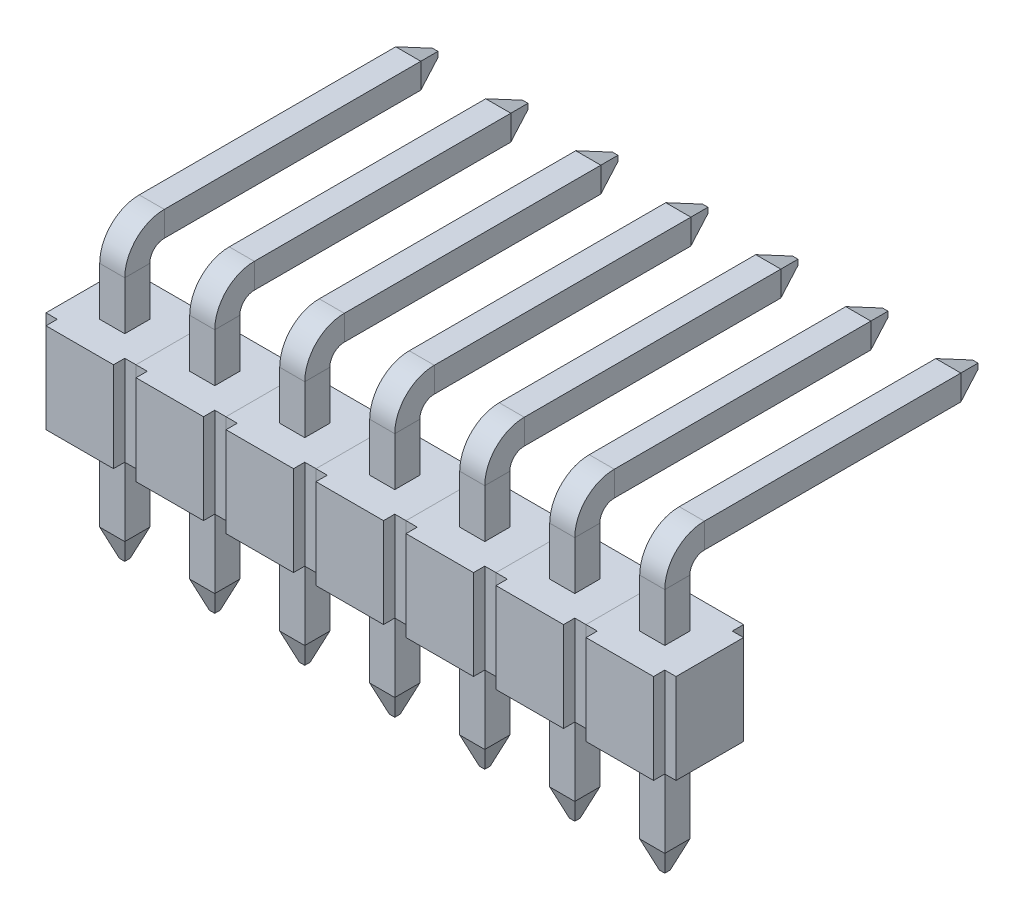
from build123d import *
from OCP.BRepFilletAPI import BRepFilletAPI_MakeChamfer

# Parameters (mm, degrees)
BOSS_EXTRUDE1_DEPTH = 1.27
SKETCH2_W           = 0.707106782
SKETCH2_H           = 0.707106782
CHAMFER1_SIZE       = 0.762
CHAMFER1_SIZE2      = 0.277345319
LPATTERN1_COUNT     = 7
LPATTERN1_PITCH     = 2.54


with BuildPart() as part:
    # Sketch1 → Boss-Extrude1 (new, symmetric)
    with BuildSketch(Plane(origin=(0, 0, 0), x_dir=(1, 0, 0), z_dir=(0, 1, 0))):
        Polygon((-0.9525, -1.27), (0.9525, -1.27), (0.9525, -0.9525), (1.27, -0.9525), (1.27, 0.9525), (0.9525, 0.9525), (0.9525, 1.27), (-0.9525, 1.27), (-0.9525, 0.9525), (-1.27, 0.9525), (-1.27, -0.9525), (-0.9525, -0.9525), align=None)
    extrude(amount=BOSS_EXTRUDE1_DEPTH, both=True)


with BuildPart() as body_2:
    # Sweep1: sweep along a path in Sketch3
    with BuildLine(Plane(origin=(0, 0, 0), x_dir=(0, 0, -1), z_dir=(1, 0, 0))) as sweep1_path:
        Line((8.763, 3.399), (0.762, 3.399))
        ThreePointArc((0.762, 3.399), (0.223184633, 3.175815367), (0, 2.637))
        Line((0, 2.637), (0, -4.572))
    # Sketch2 → Sweep1 (sweep)
    with BuildSketch(Plane(origin=(0, 0, 0), x_dir=(1, 0, 0), z_dir=(0, 1, 0))):
        Rectangle(SKETCH2_W, SKETCH2_H)
    sweep(path=sweep1_path.line)

    # Chamfer1: one chamfer whose edges measure the first distance from different faces: ONE call of the kernel's chamfer builder (chamfer() names one face for all edges)
    chamfer1_edges_1 = [body_2.edges().sort_by_distance(p)[0] for p in [
        (0, -4.572, -0.353553391),
    ]]
    chamfer1_side_1 = [body_2.faces().sort_by_distance(p)[0] for p in [
        (0, -0.9675, -0.353553391),
    ]]
    chamfer1_edges_2 = [body_2.edges().sort_by_distance(p)[0] for p in [
        (-0.353553391, -4.572, 0),
        (-0.353553391, 3.399, -8.763),
    ]]
    chamfer1_side_2 = [body_2.faces().sort_by_distance(p)[0] for p in [
        (-0.353553391, 3.168900947, -4.7625),
    ]]
    chamfer1_edges_3 = [body_2.edges().sort_by_distance(p)[0] for p in [
        (0, -4.572, 0.353553391),
    ]]
    chamfer1_side_3 = [body_2.faces().sort_by_distance(p)[0] for p in [
        (0, -0.9675, 0.353553391),
    ]]
    chamfer1_edges_4 = [body_2.edges().sort_by_distance(p)[0] for p in [
        (0.353553391, 3.399, -8.763),
        (0.353553391, -4.572, 0),
    ]]
    chamfer1_side_4 = [body_2.faces().sort_by_distance(p)[0] for p in [
        (0.353553391, 3.629099053, -4.7625),
    ]]
    chamfer1_edges_5 = [body_2.edges().sort_by_distance(p)[0] for p in [
        (0, 3.045446609, -8.763),
    ]]
    chamfer1_side_5 = [body_2.faces().sort_by_distance(p)[0] for p in [
        (0, 3.045446609, -4.7625),
    ]]
    chamfer1_edges_6 = [body_2.edges().sort_by_distance(p)[0] for p in [
        (0, 3.752553391, -8.763),
    ]]
    chamfer1_side_6 = [body_2.faces().sort_by_distance(p)[0] for p in [
        (0, 3.752553391, -4.7625),
    ]]
    chamfer1 = BRepFilletAPI_MakeChamfer(body_2.part.solid().wrapped)
    for e in chamfer1_edges_1:
        chamfer1.Add(CHAMFER1_SIZE, CHAMFER1_SIZE2, e.wrapped, chamfer1_side_1[0].wrapped)  # the first distance lies on this face
    for e in chamfer1_edges_2:
        chamfer1.Add(CHAMFER1_SIZE, CHAMFER1_SIZE2, e.wrapped, chamfer1_side_2[0].wrapped)  # the first distance lies on this face
    for e in chamfer1_edges_3:
        chamfer1.Add(CHAMFER1_SIZE, CHAMFER1_SIZE2, e.wrapped, chamfer1_side_3[0].wrapped)  # the first distance lies on this face
    for e in chamfer1_edges_4:
        chamfer1.Add(CHAMFER1_SIZE, CHAMFER1_SIZE2, e.wrapped, chamfer1_side_4[0].wrapped)  # the first distance lies on this face
    for e in chamfer1_edges_5:
        chamfer1.Add(CHAMFER1_SIZE, CHAMFER1_SIZE2, e.wrapped, chamfer1_side_5[0].wrapped)  # the first distance lies on this face
    for e in chamfer1_edges_6:
        chamfer1.Add(CHAMFER1_SIZE, CHAMFER1_SIZE2, e.wrapped, chamfer1_side_6[0].wrapped)  # the first distance lies on this face
    add(Compound.cast(chamfer1.Shape()), mode=Mode.REPLACE)


with BuildPart() as lpattern1_1:
    # LPattern1: pattern copy
    add(body_2.part.moved(Location(Vector(1, 0, 0) * (1 * LPATTERN1_PITCH))))


with BuildPart() as lpattern1_2:
    # LPattern1: pattern copy
    add(body_2.part.moved(Location(Vector(1, 0, 0) * (2 * LPATTERN1_PITCH))))


with BuildPart() as lpattern1_3:
    # LPattern1: pattern copy
    add(body_2.part.moved(Location(Vector(1, 0, 0) * (3 * LPATTERN1_PITCH))))


with BuildPart() as lpattern1_4:
    # LPattern1: pattern copy
    add(body_2.part.moved(Location(Vector(1, 0, 0) * (4 * LPATTERN1_PITCH))))


with BuildPart() as lpattern1_5:
    # LPattern1: pattern copy
    add(body_2.part.moved(Location(Vector(1, 0, 0) * (5 * LPATTERN1_PITCH))))


with BuildPart() as lpattern1_6:
    # LPattern1: pattern copy
    add(body_2.part.moved(Location(Vector(1, 0, 0) * (6 * LPATTERN1_PITCH))))


with BuildPart() as lpattern1_7:
    # LPattern1: pattern copy
    add(part.part.moved(Location(Vector(1, 0, 0) * (1 * LPATTERN1_PITCH))))


with BuildPart() as lpattern1_8:
    # LPattern1: pattern copy
    add(part.part.moved(Location(Vector(1, 0, 0) * (2 * LPATTERN1_PITCH))))


with BuildPart() as lpattern1_9:
    # LPattern1: pattern copy
    add(part.part.moved(Location(Vector(1, 0, 0) * (3 * LPATTERN1_PITCH))))


with BuildPart() as lpattern1_10:
    # LPattern1: pattern copy
    add(part.part.moved(Location(Vector(1, 0, 0) * (4 * LPATTERN1_PITCH))))


with BuildPart() as lpattern1_11:
    # LPattern1: pattern copy
    add(part.part.moved(Location(Vector(1, 0, 0) * (5 * LPATTERN1_PITCH))))


with BuildPart() as lpattern1_12:
    # LPattern1: pattern copy
    add(part.part.moved(Location(Vector(1, 0, 0) * (6 * LPATTERN1_PITCH))))


solid = Compound([part.part, body_2.part, lpattern1_1.part, lpattern1_2.part, lpattern1_3.part, lpattern1_4.part, lpattern1_5.part, lpattern1_6.part, lpattern1_7.part, lpattern1_8.part, lpattern1_9.part, lpattern1_10.part, lpattern1_11.part, lpattern1_12.part])
